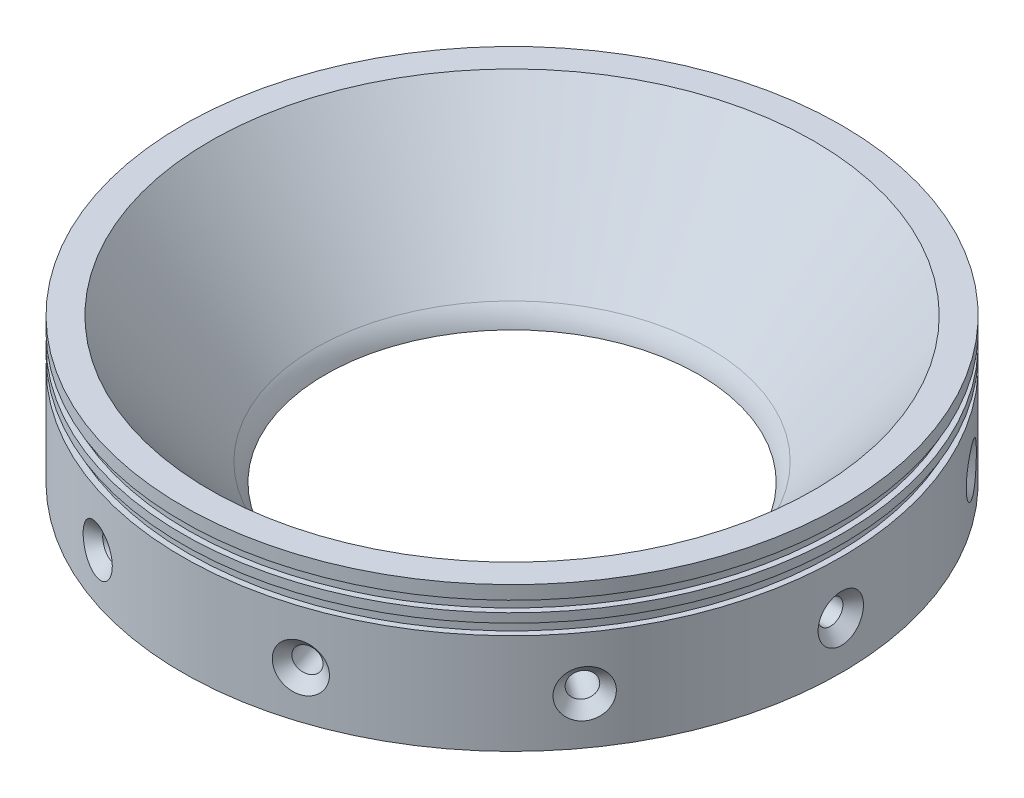
from build123d import *

# Parameters (mm, degrees)
RIPETIZIONECIRCOLARE1_COUNT = 10


with BuildPart() as part:
    # Schizzo1 → Rivoluzione1 (revolve)
    with BuildSketch(Plane.XY, mode=Mode.PRIVATE) as rivoluzione1_sk:
        with BuildLine():
            Line((-43.571791505, 66.640509339), (-66.905124838, 94.640509339))
            Line((-66.905124838, 94.640509339), (-73, 94.640509339))
            Line((-73, 94.640509339), (-73, 91.640509339))
            Line((-73, 91.640509339), (-71.7, 91.640509339))
            Line((-71.7, 91.640509339), (-71.7, 89.240509339))
            Line((-71.7, 89.240509339), (-73, 89.240509339))
            Line((-73, 89.240509339), (-73, 87.240509339))
            Line((-73, 87.240509339), (-71.7, 87.240509339))
            Line((-71.7, 87.240509339), (-71.7, 84.840509339))
            Line((-71.7, 84.840509339), (-73, 84.840509339))
            Line((-73, 84.840509339), (-73, 62.640509339))
            Line((-73, 62.640509339), (-41.373263775, 62.640509339))
            ThreePointArc((-41.373263775, 62.640509339), (-42.246292899, 64.768383115), (-43.582395462, 66.640509339))
            Line((-43.582395462, 66.640509339), (-43.571791505, 66.640509339))
        make_face()
    revolve(rivoluzione1_sk.sketch.rotate(Axis((0, 0, 0), (0, 1, 0)), 270), axis=Axis((0, 0, 0), (0, 1, 0)))

    # Schizzo5 → Foro svasato per Vite M5-1 (revolve, cut)
    with BuildSketch(Plane(origin=(-72.999997463, 73.082568282, -0.019244571), x_dir=(-0.0002636242583127693, 0, 0.9999999652511247), z_dir=(0, 1, 0))):
        Polygon((0, 0), (0, 18), (2.75, 16.347633298), (2.75, 2.45), (5.2, 0), align=None)
    foro_svasato_per_vite_m5_1 = revolve(axis=Axis((-79.349997243, 73.082568282, -0.020918585), (0.9999999652511247, 0, 0.0002636242583127693)), mode=Mode.SUBTRACT)

    # RipetizioneCircolare1: Foro svasato per Vite M5-1 ×10 about axis
    ripetizionecircolare1_axis = Axis((0, 0, 0), (0, -1, 0))
    for i in range(1, RIPETIZIONECIRCOLARE1_COUNT):
        add(foro_svasato_per_vite_m5_1.rotate(ripetizionecircolare1_axis, i * 360 / RIPETIZIONECIRCOLARE1_COUNT), mode=Mode.SUBTRACT)


solid = part.part
